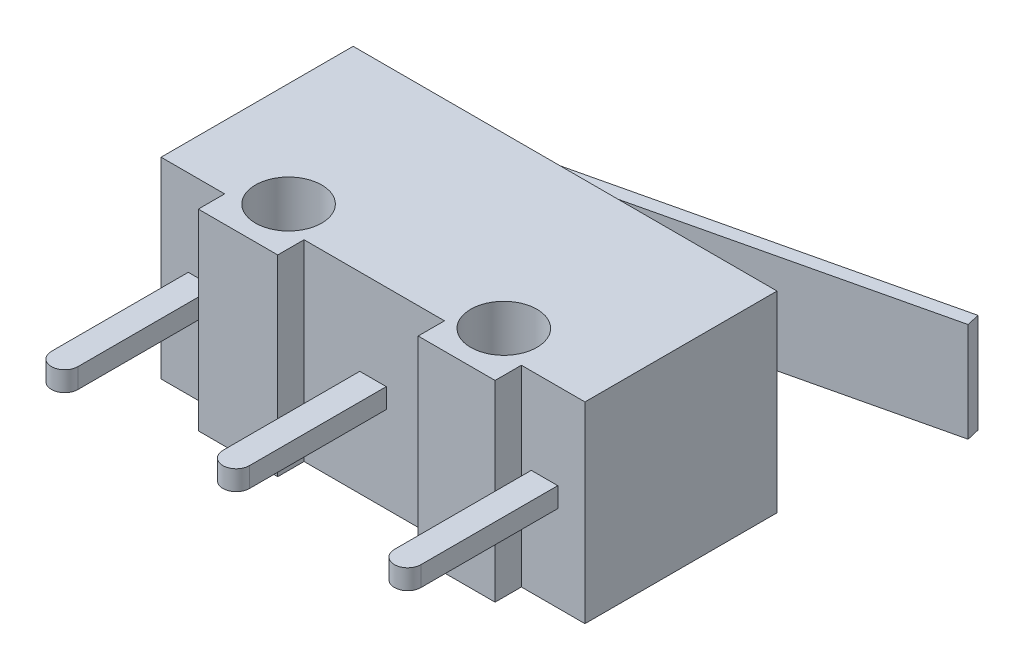
from build123d import *

# Parameters (mm, degrees)
SKETCH1_R           = 1
BOSS_EXTRUDE1_DEPTH = 5.8
EXTRUDE_THIN1_DEPTH = 1.5
BOSS_EXTRUDE2_DEPTH = 0.3


with BuildPart() as part:
    # Sketch1 → Boss-Extrude1 (new body)
    with BuildSketch(Plane(origin=(0, 0, 0), x_dir=(1, 0, 0), z_dir=(0, 1, 0))):
        Polygon((6.4, 0), (6.4, 5.8), (-6.4, 5.8), (-6.4, 0), (-4.480616855, 0), (-4.480616855, -0.794991669), (-2.082638034, -0.794991669), (-2.082638034, 0), (2.15791372, 0), (2.15791372, -0.794991669), (4.480616855, -0.794991669), (4.480616855, 0), align=None)
        with Locations(Location((3.25, 0.7, 0), (0, 0, 270))):
            Circle(SKETCH1_R, mode=Mode.SUBTRACT)
        with Locations(Location((-3.25, 0.7, 0), (0, 0, 270))):
            Circle(SKETCH1_R, mode=Mode.SUBTRACT)
    extrude(amount=BOSS_EXTRUDE1_DEPTH)

    # Sketch2 → Extrude-Thin1 (add, symmetric)
    with BuildSketch(Plane(origin=(0, 2.9, 0), x_dir=(1, 0, 0), z_dir=(0, 1, 0))):
        with BuildLine():
            Line((8.670419942, 9.598188691), (-4.715076855, 6.45728949))
            ThreePointArc((-4.715076855, 6.45728949), (-5.101788699, 6.233385099), (-5.299071375, 5.832437755))
            Line((-5.299071375, 5.832437755), (-4.904367476, 5.767562245))
            ThreePointArc((-4.904367476, 5.767562245), (-4.80955319, 5.960258009), (-4.623699024, 6.067866722))
            Line((-4.623699024, 6.067866722), (8.761797773, 9.208765923))
            Line((8.761797773, 9.208765923), (8.670419942, 9.598188691))
        make_face()
    extrude(amount=EXTRUDE_THIN1_DEPTH, both=True)

    # Sketch3 → Boss-Extrude2 (add, symmetric)
    with BuildSketch(Plane(origin=(0, 2.9, 0), x_dir=(1, 0, 0), z_dir=(0, 1, 0))):
        with BuildLine():
            Line((-5.579037079, 0), (-5.579037079, -4.131158505))
            ThreePointArc((-5.579037079, -4.131158505), (-5.179037079, -4.531158505), (-4.779037079, -4.131158505))
            Line((-4.779037079, -4.131158505), (-4.779037079, 0))
            Line((-4.779037079, 0), (-5.579037079, 0))
        make_face()
        with BuildLine():
            Line((-0.4, -4.131158505), (-0.4, 0))
            Line((-0.4, 0), (0.4, 0))
            Line((0.4, 0), (0.4, -4.131158505))
            ThreePointArc((0.4, -4.131158505), (0, -4.531158505), (-0.4, -4.131158505))
        make_face()
        with BuildLine():
            Line((4.779037079, 0), (5.579037079, 0))
            Line((5.579037079, 0), (5.579037079, -4.131158505))
            ThreePointArc((5.579037079, -4.131158505), (5.179037079, -4.531158505), (4.779037079, -4.131158505))
            Line((4.779037079, -4.131158505), (4.779037079, 0))
        make_face()
    extrude(amount=BOSS_EXTRUDE2_DEPTH, both=True)


solid = part.part
